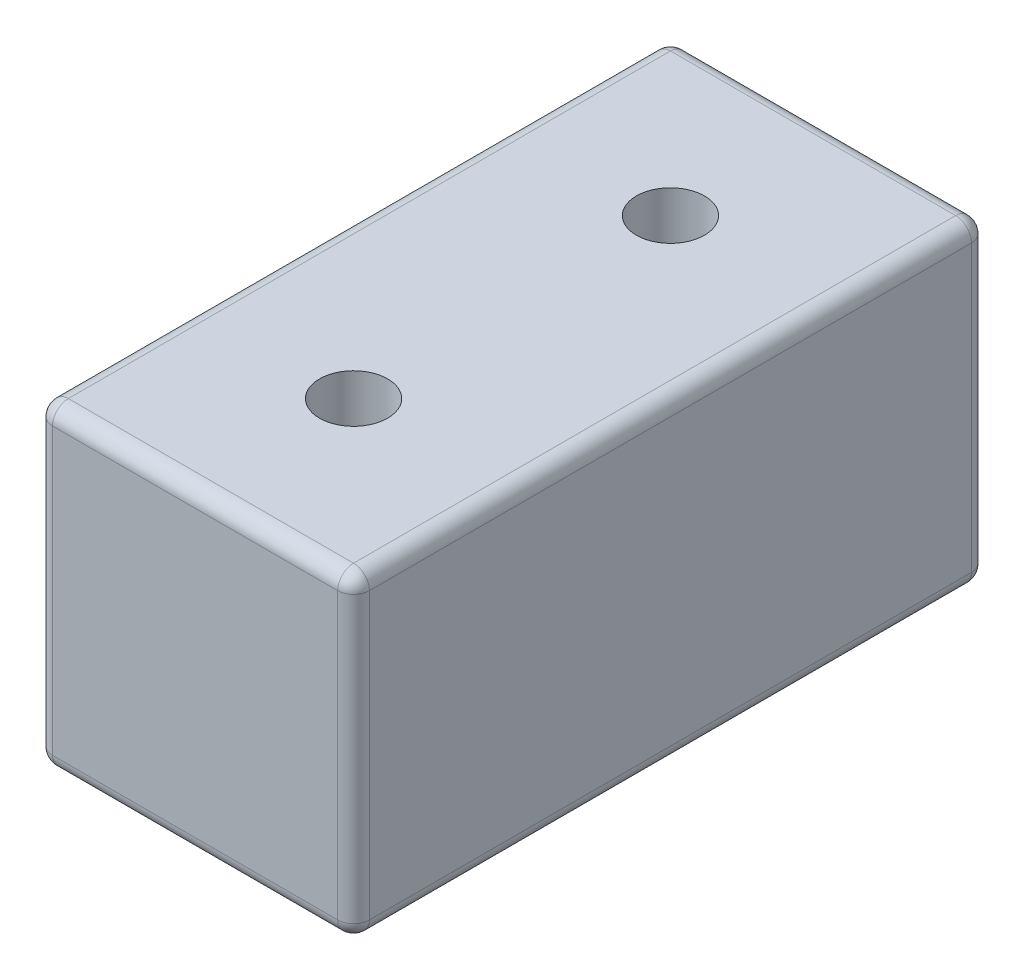
from build123d import *

# Parameters (mm, degrees)
SKETCH_1_W          = 20
SKETCH_1_H          = 20
EXTRUDE_1_DEPTH     = 40
SKETCH_2_R          = 2.15
CUT_EXTRUDE_1_DEPTH = 40
FILLET_2_R          = 1


with BuildPart() as part:
    # 草图1 → 凸台-拉伸1 (new body)
    with BuildSketch(Plane.XY):
        with Locations((10, 10)):
            Rectangle(SKETCH_1_W, SKETCH_1_H)
    extrude(amount=EXTRUDE_1_DEPTH)

    # 草图2 → 切除-拉伸1 (cut)
    with BuildSketch(Plane(origin=(0, 20, 0), x_dir=(1, 0, 0), z_dir=(0, 1, 0))):
        with Locations(Location((10, -30, 0), (0, 0, 270))):
            Circle(SKETCH_2_R)
        with Locations(Location((10, -10, 0), (0, 0, 270))):
            Circle(SKETCH_2_R)
    extrude(amount=-CUT_EXTRUDE_1_DEPTH, mode=Mode.SUBTRACT)

    # 圆角2
    fillet_2_edges = [part.edges().sort_by_distance(p)[0] for p in [
        (20, 10, 40),
        (10, 20, 40),
        (0, 10, 40),
        (10, 20, 0),
        (20, 10, 0),
        (10, 0, 0),
        (0, 10, 0),
        (0, 20, 20),
        (20, 20, 20),
        (20, 0, 20),
        (0, 0, 20),
        (10, 0, 40),
    ]]
    fillet(fillet_2_edges, radius=FILLET_2_R)


solid = part.part
